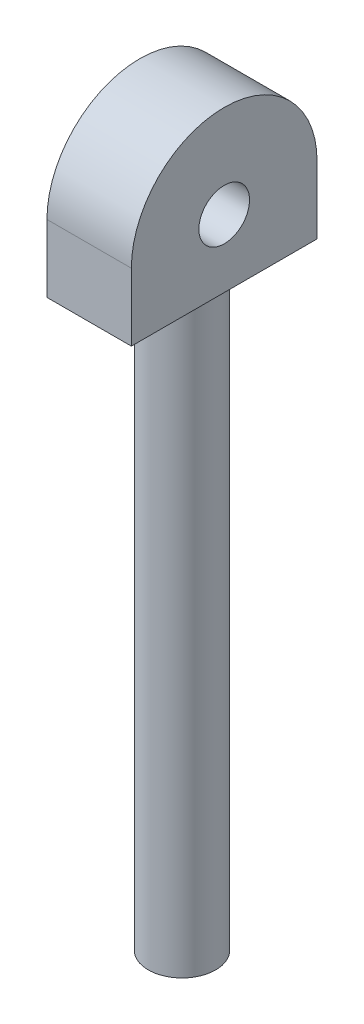
from build123d import *

# Parameters (mm, degrees)
SKETCH1_R           = 1.5
BOSS_EXTRUDE1_DEPTH = 5
SKETCH2_R           = 2
BOSS_EXTRUDE2_DEPTH = 35


with BuildPart() as part:
    # Sketch1 → Boss-Extrude1 (new body)
    with BuildSketch(Plane(origin=(0, 0, 0), x_dir=(0, 0, -1), z_dir=(1, 0, 0))):
        with BuildLine():
            Line((-5.5, 2), (-5.5, -2))
            Line((-5.5, -2), (5.5, -2))
            Line((5.5, -2), (5.5, 2))
            ThreePointArc((5.5, 2), (0, 7.5), (-5.5, 2))
        make_face()
        with Locations((0, 2)):
            Circle(SKETCH1_R, mode=Mode.SUBTRACT)
    extrude(amount=BOSS_EXTRUDE1_DEPTH)

    # Sketch2 → Boss-Extrude2 (add)
    with BuildSketch(Plane.XZ.offset(2)):
        with Locations(Location((2.5, 0, 0), (0, 0, 270))):
            Circle(SKETCH2_R)
    extrude(amount=BOSS_EXTRUDE2_DEPTH)


solid = part.part
